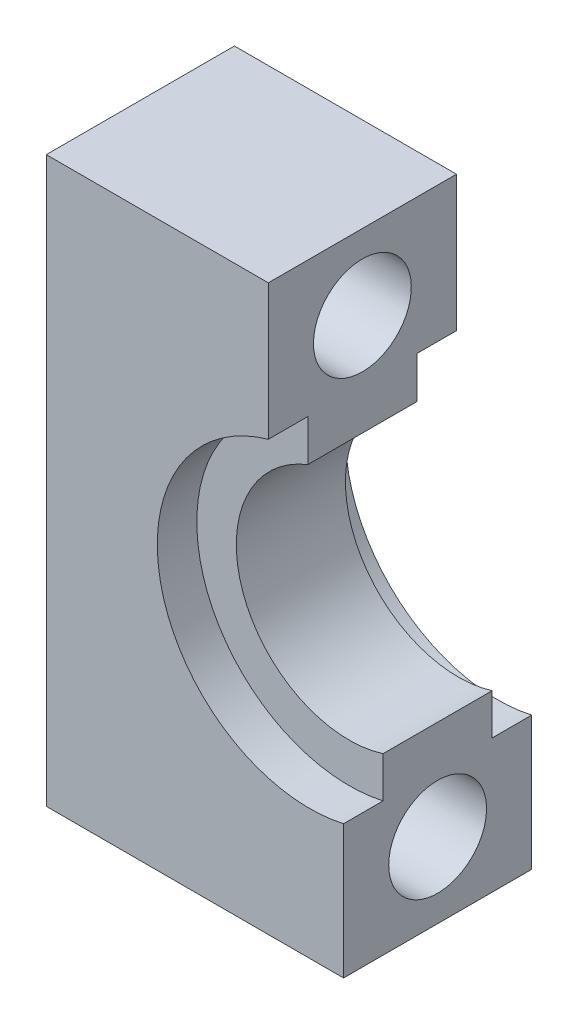
from build123d import *

# Parameters (mm, degrees)
BOSS_EXTRUDE2_DEPTH = 5
BOSS_EXTRUDE3_DEPTH = 2.9
CUT_EXTRUDE1_REACH  = 24.353
SKETCH5_R           = 2.6


with BuildPart() as part:
    # Sketch3 → Boss-Extrude2 (new, symmetric)
    with BuildSketch(Plane.XY):
        with BuildLine():
            Line((0, -15), (0, 15))
            Line((0, 15), (11.8, 15))
            Line((11.8, 15), (11.8, 7.795511529))
            ThreePointArc((11.8, 7.795511529), (6.150961765, -2.000649589), (15.8, -7.897467949))
            Line((15.8, -7.897467949), (15.8, -15))
            Line((15.8, -15), (0, -15))
        make_face()
    extrude(amount=BOSS_EXTRUDE2_DEPTH, both=True)

    # Sketch4 → Boss-Extrude3 (add, symmetric)
    with BuildSketch(Plane.XY):
        with BuildLine():
            Line((11.8, 8.21035931), (11.8, 5.582114295))
            ThreePointArc((11.8, 5.582114295), (8.343588332, -2.001251369), (15.8, -5.723635209))
            Line((15.8, -5.723635209), (15.8, -8.30722577))
            ThreePointArc((15.8, -8.30722577), (5.738786153, -2.000586358), (11.8, 8.21035931))
        make_face()
    extrude(amount=BOSS_EXTRUDE3_DEPTH, both=True)

    # Sketch5 → Cut-Extrude1 (cut, up to next)
    with BuildSketch(Plane(origin=(0, 0, 0), x_dir=(0, 0, -1), z_dir=(1, 0, 0)), mode=Mode.PRIVATE) as cut_extrude1_sk1:
        with Locations(Location((0, 11, 0), (0, 0, 270))):
            Circle(SKETCH5_R)
    cut_extrude1_tool1 = extrude(cut_extrude1_sk1.sketch, amount=CUT_EXTRUDE1_REACH, mode=Mode.PRIVATE) & part.part
    # Sketch5 → Cut-Extrude1 (cut, up to next)
    with BuildSketch(Plane(origin=(0, 0, 0), x_dir=(0, 0, -1), z_dir=(1, 0, 0)), mode=Mode.PRIVATE) as cut_extrude1_sk2:
        with Locations(Location((0, -11, 0), (0, 0, 180))):
            Circle(SKETCH5_R)
    cut_extrude1_tool2 = extrude(cut_extrude1_sk2.sketch, amount=CUT_EXTRUDE1_REACH, mode=Mode.PRIVATE) & part.part
    add(cut_extrude1_tool1.solids().sort_by_distance((0, 11, 0))[0], mode=Mode.SUBTRACT)
    add(cut_extrude1_tool2.solids().sort_by_distance((0, -11, 0))[0], mode=Mode.SUBTRACT)


solid = part.part
